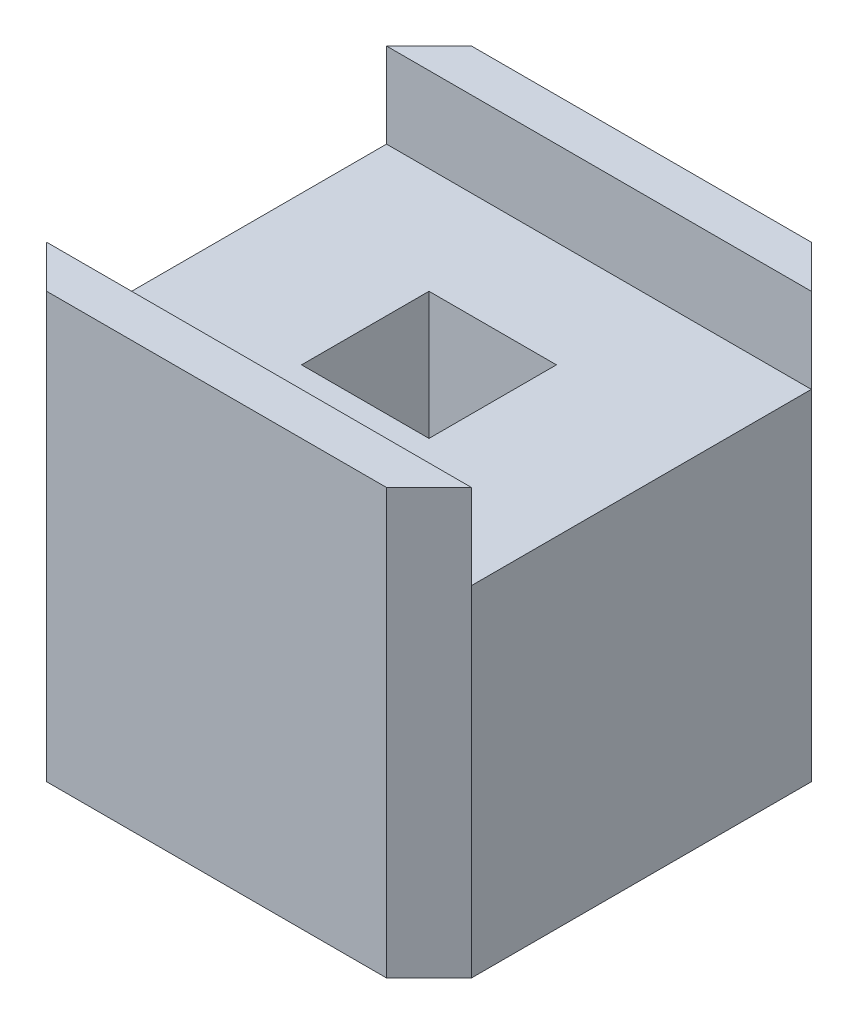
from build123d import *

# Parameters (mm, degrees)
SKETCH1_W           = 0.75
SKETCH1_H           = 0.75
BOSS_EXTRUDE1_DEPTH = 2.5
SKETCH2_W           = 2.5
SKETCH2_H           = 2
CUT_EXTRUDE1_DEPTH  = 0.5


with BuildPart() as part:
    # Sketch1 → Boss-Extrude1 (new body)
    with BuildSketch(Plane(origin=(0, 0, 0), x_dir=(1, 0, 0), z_dir=(0, 1, 0))):
        Polygon((-1.25, 1), (-1, 1.25), (1, 1.25), (1.25, 1), (1.25, -1), (1, -1.25), (-1, -1.25), (-1.25, -1), align=None)
        Rectangle(SKETCH1_W, SKETCH1_H, mode=Mode.SUBTRACT)
    extrude(amount=BOSS_EXTRUDE1_DEPTH)

    # Sketch2 → Cut-Extrude1 (cut)
    with BuildSketch(Plane(origin=(0, 2.5, 0), x_dir=(1, 0, 0), z_dir=(0, 1, 0))):
        Rectangle(SKETCH2_W, SKETCH2_H)
    extrude(amount=-CUT_EXTRUDE1_DEPTH, mode=Mode.SUBTRACT)


solid = part.part
